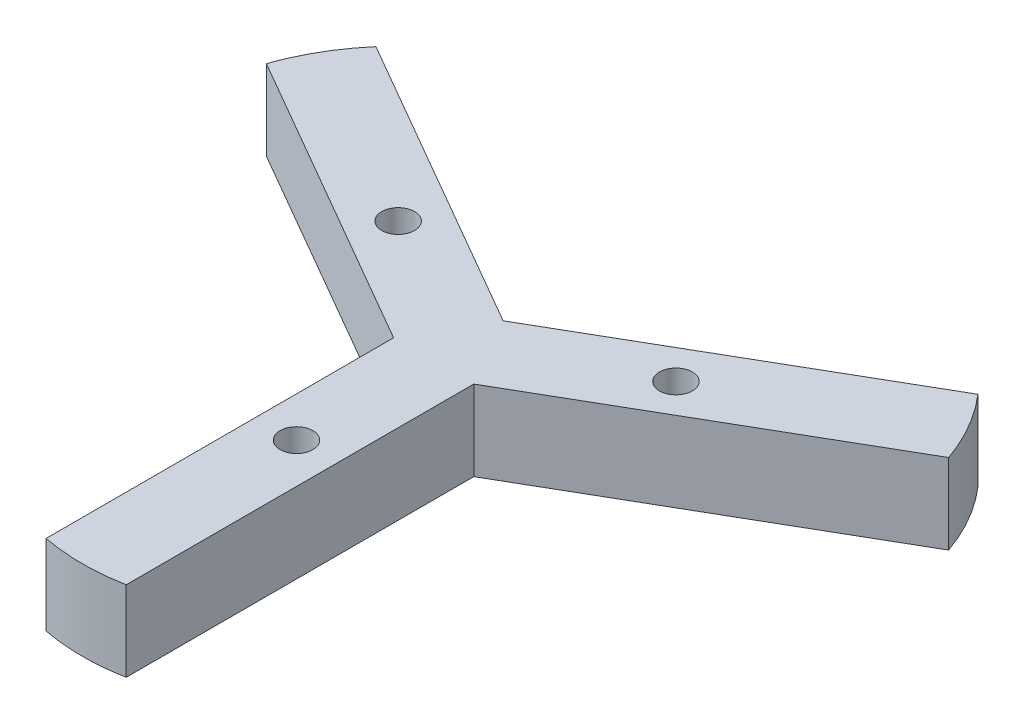
from build123d import *

# Parameters (mm, degrees)
SKETCH1_R           = 2.6035
BOSS_EXTRUDE1_DEPTH = 12.7


with BuildPart() as part:
    # Sketch1 → Boss-Extrude1 (new body)
    with BuildSketch(Plane(origin=(0, 0, 0), x_dir=(1, 0, 0), z_dir=(0, 1, 0))):
        with BuildLine():
            Line((6.35, -3.666174209), (6.35, -58.718791294))
            ThreePointArc((6.35, -58.718791294), (0, -59.31849574), (-6.35, -58.718791294))
            Line((-6.35, -58.718791294), (-6.35, -3.666174209))
            Line((-6.35, -3.666174209), (-54.02696494, 23.860134333))
            ThreePointArc((-54.02696494, 23.860134333), (-51.371324225, 29.65924787), (-47.67696494, 34.858656961))
            Line((-47.67696494, 34.858656961), (0, 7.332348419))
            Line((0, 7.332348419), (47.67696494, 34.858656961))
            ThreePointArc((47.67696494, 34.858656961), (51.371324225, 29.65924787), (54.02696494, 23.860134333))
            Line((54.02696494, 23.860134333), (6.35, -3.666174209))
        make_face()
        with Locations(Location((0, -25.4, 0), (0, 0, 270))):
            Circle(SKETCH1_R, mode=Mode.SUBTRACT)
        with Locations(Location((-21.997045256, 12.7, 0), (0, 0, 270))):
            Circle(SKETCH1_R, mode=Mode.SUBTRACT)
        with Locations(Location((21.997045256, 12.7, 0), (0, 0, 270))):
            Circle(SKETCH1_R, mode=Mode.SUBTRACT)
    extrude(amount=BOSS_EXTRUDE1_DEPTH)


solid = part.part
